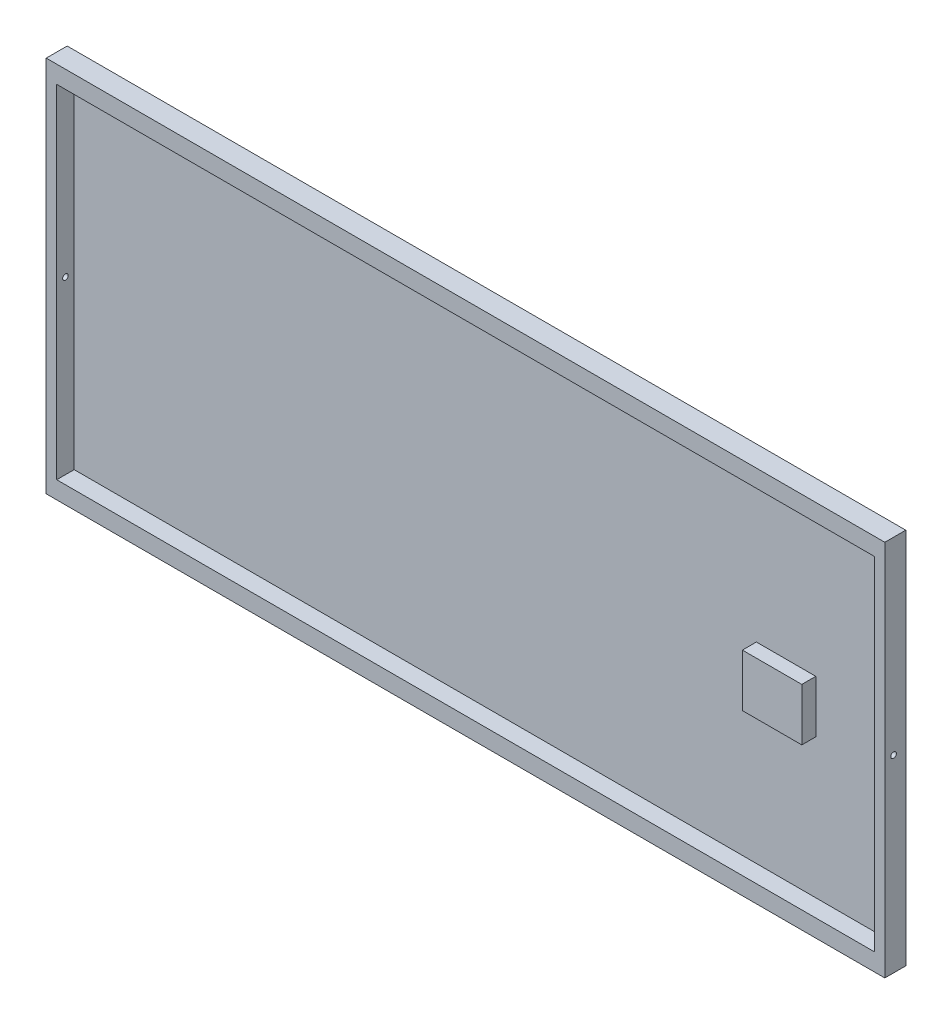
from build123d import *

# Parameters (mm, degrees)
SKETCH_1_W          = 1200
SKETCH_1_H          = 540
EXTRUDE_1_DEPTH     = 30
SKETCH_2_W          = 1170
SKETCH_2_H          = 490
CUT_EXTRUDE_1_DEPTH = 25
SKETCH_3_R          = 4
CUT_EXTRUDE_2_DEPTH = 12000
SKETCH_4_W          = 85
SKETCH_4_H          = 75
EXTRUDE_2_DEPTH     = 20
SKETCH_5_R          = 2.5
EXTRUDE_3_DEPTH     = 5


with BuildPart() as part:
    # 草图1 → 凸台-拉伸1 (new body)
    with BuildSketch(Plane.XY):
        with Locations((539.460495659, -244.775206524)):
            Rectangle(SKETCH_1_W, SKETCH_1_H)
    extrude(amount=EXTRUDE_1_DEPTH)

    # 草图2 → 切除-拉伸1 (cut)
    with BuildSketch(Plane.XY.offset(30)):
        with Locations((539.460495659, -244.775206524)):
            Rectangle(SKETCH_2_W, SKETCH_2_H)
    extrude(amount=-CUT_EXTRUDE_1_DEPTH, mode=Mode.SUBTRACT)

    # 草图3 → 切除-拉伸2 (cut)
    with BuildSketch(Plane.ZY.offset(60.539504341)):
        with Locations(Location((17.5, -244.775206524, 0), (0, 0, 180))):
            Circle(SKETCH_3_R)
    extrude(amount=-CUT_EXTRUDE_2_DEPTH, mode=Mode.SUBTRACT)

    # 草图4 → 凸台-拉伸2 (add)
    with BuildSketch(Plane.XY.offset(5)):
        with Locations((973.172943193, -252.800296094)):
            Rectangle(SKETCH_4_W, SKETCH_4_H)
    extrude(amount=EXTRUDE_2_DEPTH)

    # 草图5 → 凸台-拉伸3 (add)
    with BuildSketch(Plane.ZY.offset(-930.672943193)):
        with Locations(Location((15.686983343, -230.168976304, 0), (0, 0, 90))):
            Circle(SKETCH_5_R)
        with Locations(Location((15.686983343, -239.791974012, 0), (0, 0, 90))):
            Circle(SKETCH_5_R)
    extrude(amount=EXTRUDE_3_DEPTH)


solid = part.part
